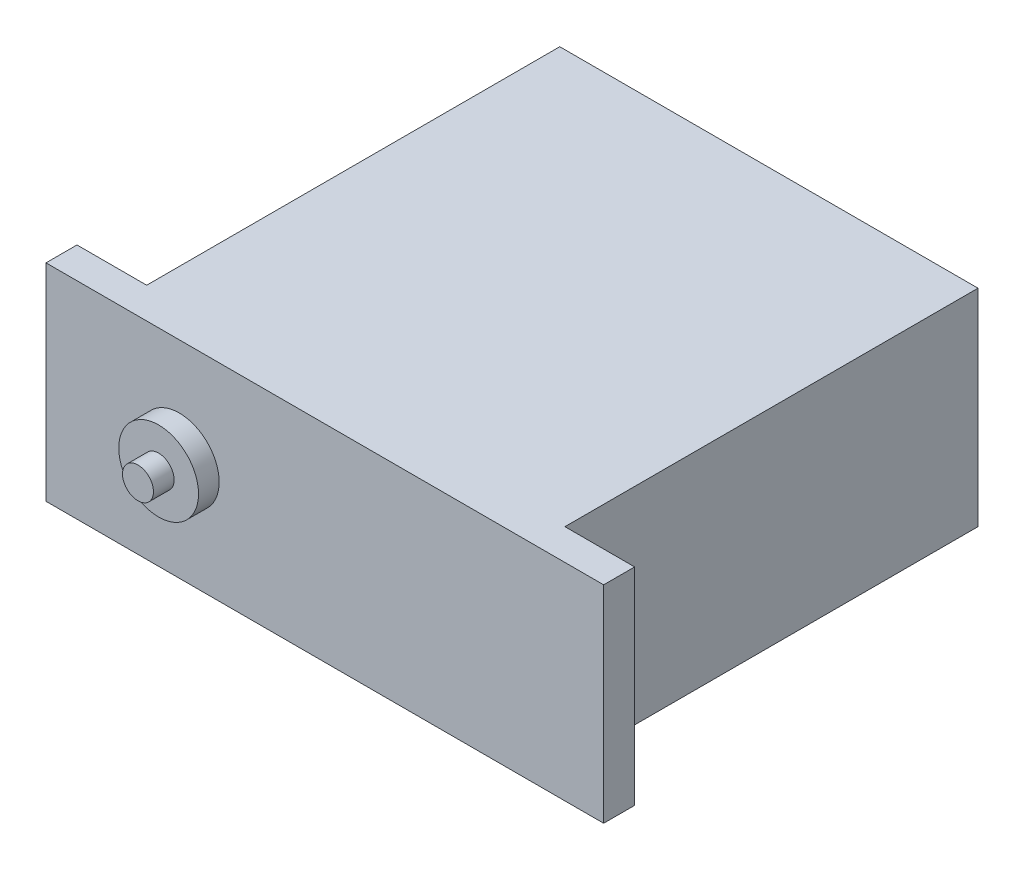
from build123d import *

# Parameters (mm, degrees)
SKETCH_1_W      = 40.5
SKETCH_1_H      = 20
EXTRUDE_1_DEPTH = 40
SKETCH_2_W      = 54
SKETCH_2_H      = 20
EXTRUDE_2_DEPTH = 3
SKETCH_3_R      = 3.862973326
EXTRUDE_3_DEPTH = 2
SKETCH_4_R      = 1.5
EXTRUDE_4_DEPTH = 2


with BuildPart() as part:
    # 草图1 → 凸台-拉伸1 (new body)
    with BuildSketch(Plane.XY):
        Rectangle(SKETCH_1_W, SKETCH_1_H)
    extrude(amount=EXTRUDE_1_DEPTH)

    # 草图2 → 凸台-拉伸2 (add)
    with BuildSketch(Plane.XY.offset(40)):
        Rectangle(SKETCH_2_W, SKETCH_2_H)
    extrude(amount=EXTRUDE_2_DEPTH)

    # 草图3 → 凸台-拉伸3 (add)
    with BuildSketch(Plane.XY.offset(43)):
        with Locations(Location((-14.092481913, 0, 0), (0, 0, 180))):
            Circle(SKETCH_3_R)
    extrude(amount=EXTRUDE_3_DEPTH)

    # 草图4 → 凸台-拉伸4 (add)
    with BuildSketch(Plane.XY.offset(45)):
        with Locations((-14.092481913, 0)):
            Circle(SKETCH_4_R)
    extrude(amount=EXTRUDE_4_DEPTH)


solid = part.part
